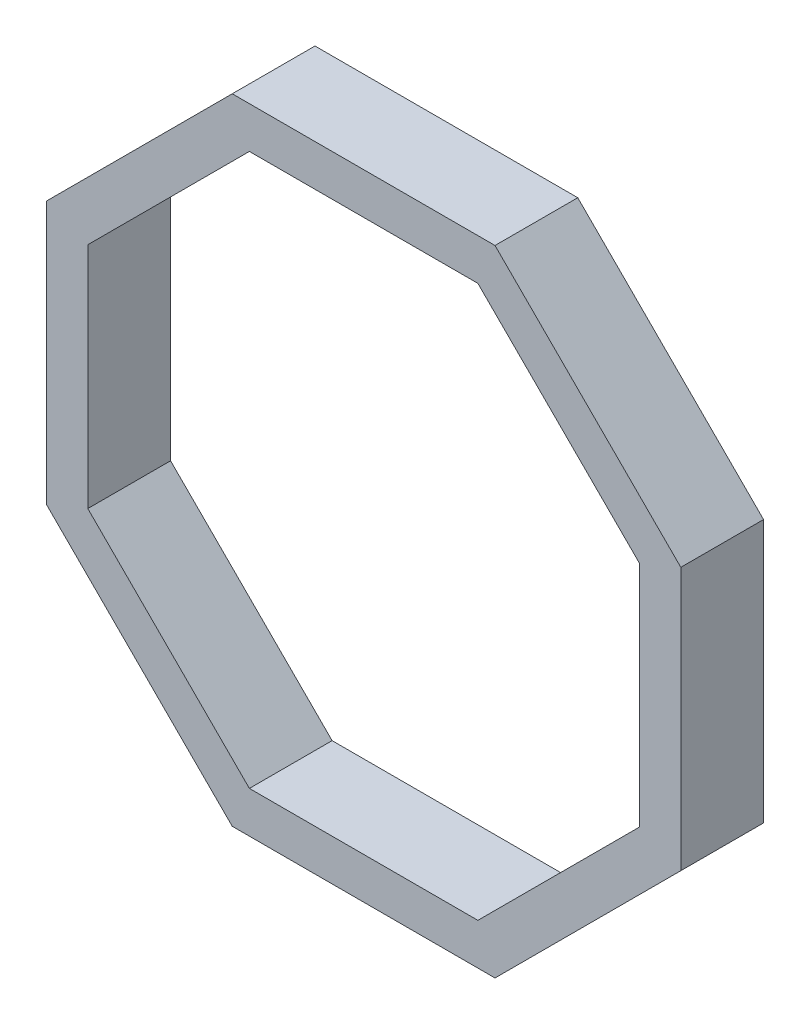
from build123d import *

# Parameters (mm, degrees)
RESSALTO_EXTRUS_O1_DEPTH = 30


with BuildPart() as part:
    # Esboço1 → Ressalto-extrusão1 (new body)
    with BuildSketch(Plane.XY):
        Polygon((115, 47.634559673), (47.634559673, 115), (-47.634559673, 115), (-115, 47.634559673), (-115, -47.634559673), (-47.634559673, -115), (47.634559673, -115), (115, -47.634559673), align=None)
        Polygon((100, 41.421356237), (41.421356237, 100), (-41.421356237, 100), (-100, 41.421356237), (-100, -41.421356237), (-41.421356237, -100), (41.421356237, -100), (100, -41.421356237), align=None, mode=Mode.SUBTRACT)
    extrude(amount=RESSALTO_EXTRUS_O1_DEPTH)


solid = part.part
